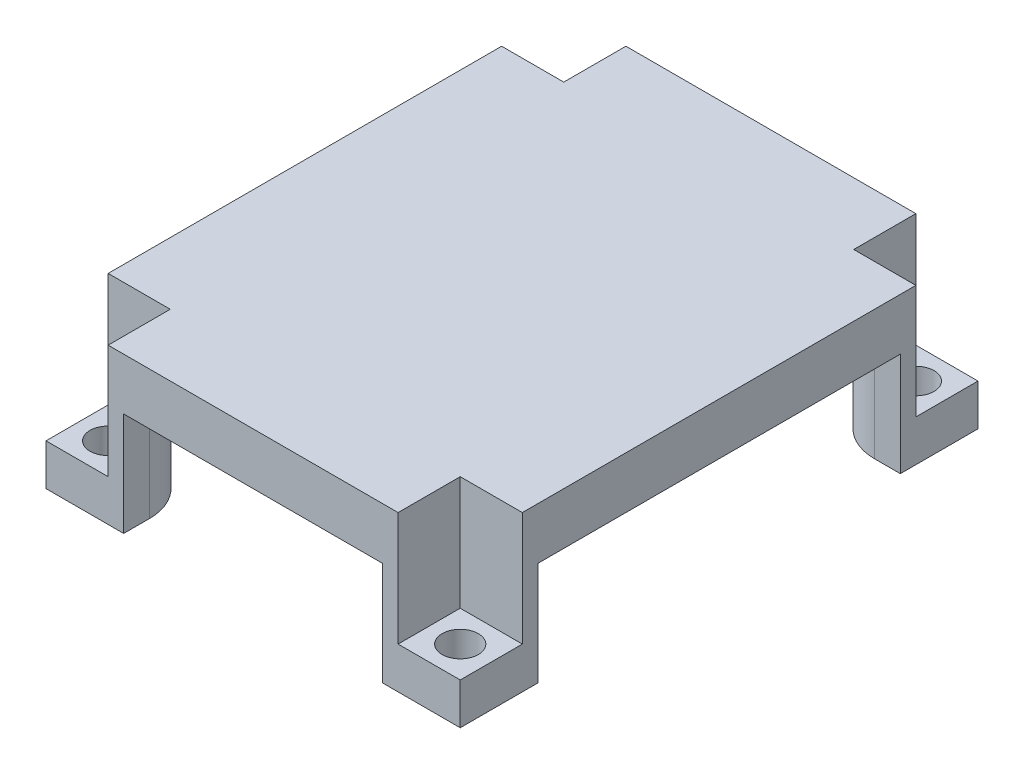
from build123d import *

# Parameters (mm, degrees)
CROQUIS1_W                = 40
CROQUIS1_H                = 50
SALIENTE_EXTRUIR1_DEPTH   = 15
CROQUIS2_R                = 1.75
CORTAR_EXTRUIR1_DEPTH     = 15
SIMETR_A2_COPY_1_SKETCH_R = 1.75
SIMETR_A2_COPY_1_DEPTH    = 15
CROQUIS3_W                = 6
CROQUIS3_H                = 6
CORTAR_EXTRUIR6_DEPTH     = 11
SIMETR_A4_COPY_1_SKETCH_W = 6
SIMETR_A4_COPY_1_SKETCH_H = 6
SIMETR_A4_COPY_1_DEPTH    = 11
CROQUIS4_W                = 35
CROQUIS4_H                = 10
CORTAR_EXTRUIR7_DEPTH     = 50.497474683
CROQUIS5_W                = 25
CROQUIS5_H                = 10
CORTAR_EXTRUIR8_DEPTH     = 56.901699437
REDONDEO1_R               = 5


with BuildPart() as part:
    # Croquis1 → Saliente-Extruir1 (new body)
    with BuildSketch(Plane(origin=(0, 0, 0), x_dir=(1, 0, 0), z_dir=(0, 1, 0))):
        Rectangle(CROQUIS1_W, CROQUIS1_H)
    extrude(amount=SALIENTE_EXTRUIR1_DEPTH)

    # Croquis2 → Cortar-Extruir1 (cut)
    with BuildSketch(Plane(origin=(0, 15, 0), x_dir=(1, 0, 0), z_dir=(0, 1, 0))):
        with Locations(Location((-17, 22, 0), (0, 0, 270))):
            Circle(CROQUIS2_R)
    cortar_extruir1 = extrude(amount=-CORTAR_EXTRUIR1_DEPTH, mode=Mode.SUBTRACT)

    # Simetría1: Cortar-Extruir1 across plane
    add(cortar_extruir1.mirror(Plane(origin=(0, 0, 0), x_dir=(0, 0, 1), z_dir=(1, 0, 0))), mode=Mode.SUBTRACT)

    # Simetría2: Cortar-Extruir1 across plane
    add(cortar_extruir1.mirror(Plane.XY), mode=Mode.SUBTRACT)

    # Simetría2 copy 1 sketch → Simetría2 copy 1 (cut)
    with BuildSketch(Plane(origin=(0, 15, 0), x_dir=(-1, 0, 0), z_dir=(0, 1, 0))):
        with Locations(Location((-17, 22, 0), (0, 0, 270))):
            Circle(SIMETR_A2_COPY_1_SKETCH_R)
    extrude(amount=-SIMETR_A2_COPY_1_DEPTH, mode=Mode.SUBTRACT)

    # Croquis3 → Cortar-Extruir6 (cut)
    with BuildSketch(Plane(origin=(0, 15, 0), x_dir=(1, 0, 0), z_dir=(0, 1, 0))):
        with Locations((-17, 22)):
            Rectangle(CROQUIS3_W, CROQUIS3_H)
    cortar_extruir6 = extrude(amount=-CORTAR_EXTRUIR6_DEPTH, mode=Mode.SUBTRACT)

    # Simetría3: Cortar-Extruir6 across plane
    add(cortar_extruir6.mirror(Plane(origin=(0, 0, 0), x_dir=(0, 0, 1), z_dir=(1, 0, 0))), mode=Mode.SUBTRACT)

    # Simetría4: Cortar-Extruir6 across plane
    add(cortar_extruir6.mirror(Plane.XY), mode=Mode.SUBTRACT)

    # Simetría4 copy 1 sketch → Simetría4 copy 1 (cut)
    with BuildSketch(Plane(origin=(0, 15, 0), x_dir=(-1, 0, 0), z_dir=(0, 1, 0))):
        with Locations((-17, 22)):
            Rectangle(SIMETR_A4_COPY_1_SKETCH_W, SIMETR_A4_COPY_1_SKETCH_H)
    extrude(amount=-SIMETR_A4_COPY_1_DEPTH, mode=Mode.SUBTRACT)

    # Croquis4 → Cortar-Extruir7 (cut, through all)
    with BuildSketch(Plane.ZY.offset(20)):
        with Locations((0, 5)):
            Rectangle(CROQUIS4_W, CROQUIS4_H)
    extrude(amount=-CORTAR_EXTRUIR7_DEPTH, mode=Mode.SUBTRACT)

    # Croquis5 → Cortar-Extruir8 (cut, through all)
    with BuildSketch(Plane.XY.offset(25)):
        with Locations((0, 5)):
            Rectangle(CROQUIS5_W, CROQUIS5_H)
    extrude(amount=-CORTAR_EXTRUIR8_DEPTH, mode=Mode.SUBTRACT)

    # Redondeo1
    redondeo1_edges = [part.edges().sort_by_distance(p)[0] for p in [
        (12.5, 5, 17.5),
        (-12.5, 5, 17.5),
        (-12.5, 5, -17.5),
        (12.5, 5, -17.5),
    ]]
    fillet(redondeo1_edges, radius=REDONDEO1_R)


solid = part.part
